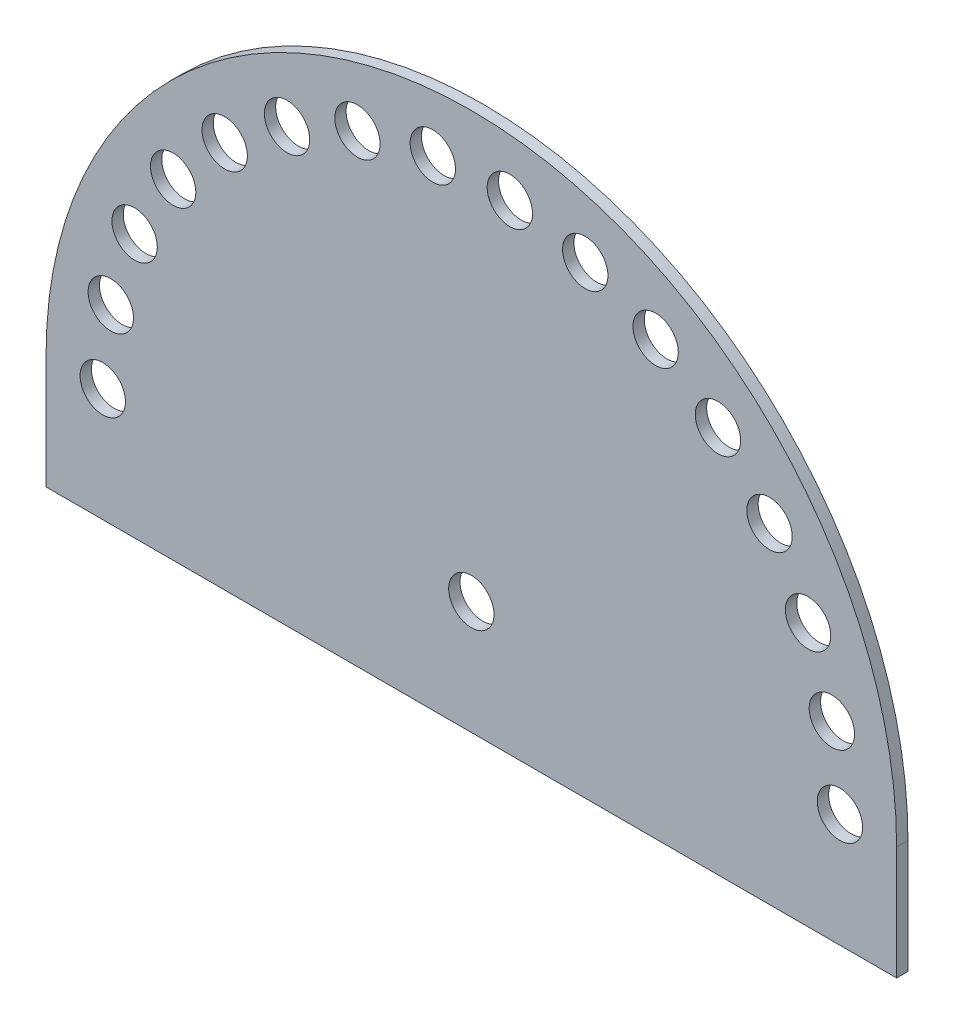
from build123d import *

# Parameters (mm, degrees)
SKETCH1_R           = 4
BOSS_EXTRUDE1_DEPTH = 2


with BuildPart() as part:
    # Sketch1 → Boss-Extrude1 (new body)
    with BuildSketch(Plane.XY):
        with BuildLine():
            Line((-75, 0), (-75, -20))
            Line((-75, -20), (75, -20))
            Line((75, -20), (75, 0))
            ThreePointArc((75, 0), (0, 75), (-75, 0))
        make_face()
        with Locations((-65, 0)):
            Circle(SKETCH1_R, mode=Mode.SUBTRACT)
        Circle(SKETCH1_R, mode=Mode.SUBTRACT)
        with Locations((-63.579594048, 13.514259903)):
            Circle(SKETCH1_R, mode=Mode.SUBTRACT)
        with Locations((-59.380454747, 26.4378818)):
            Circle(SKETCH1_R, mode=Mode.SUBTRACT)
        with Locations((-52.586104634, 38.206041399)):
            Circle(SKETCH1_R, mode=Mode.SUBTRACT)
        with Locations((-43.493489413, 48.304413656)):
            Circle(SKETCH1_R, mode=Mode.SUBTRACT)
        with Locations((-32.5, 56.291651246)):
            Circle(SKETCH1_R, mode=Mode.SUBTRACT)
        with Locations((-20.086104634, 61.818673559)):
            Circle(SKETCH1_R, mode=Mode.SUBTRACT)
        with Locations((-6.794350112, 64.643923199)):
            Circle(SKETCH1_R, mode=Mode.SUBTRACT)
        with Locations((6.794350112, 64.643923199)):
            Circle(SKETCH1_R, mode=Mode.SUBTRACT)
        with Locations((20.086104634, 61.818673559)):
            Circle(SKETCH1_R, mode=Mode.SUBTRACT)
        with Locations((32.5, 56.291651246)):
            Circle(SKETCH1_R, mode=Mode.SUBTRACT)
        with Locations((43.493489413, 48.304413656)):
            Circle(SKETCH1_R, mode=Mode.SUBTRACT)
        with Locations((52.586104634, 38.206041399)):
            Circle(SKETCH1_R, mode=Mode.SUBTRACT)
        with Locations((59.380454747, 26.4378818)):
            Circle(SKETCH1_R, mode=Mode.SUBTRACT)
        with Locations((63.579594048, 13.514259903)):
            Circle(SKETCH1_R, mode=Mode.SUBTRACT)
        with Locations((65, 0)):
            Circle(SKETCH1_R, mode=Mode.SUBTRACT)
    extrude(amount=BOSS_EXTRUDE1_DEPTH)


solid = part.part
